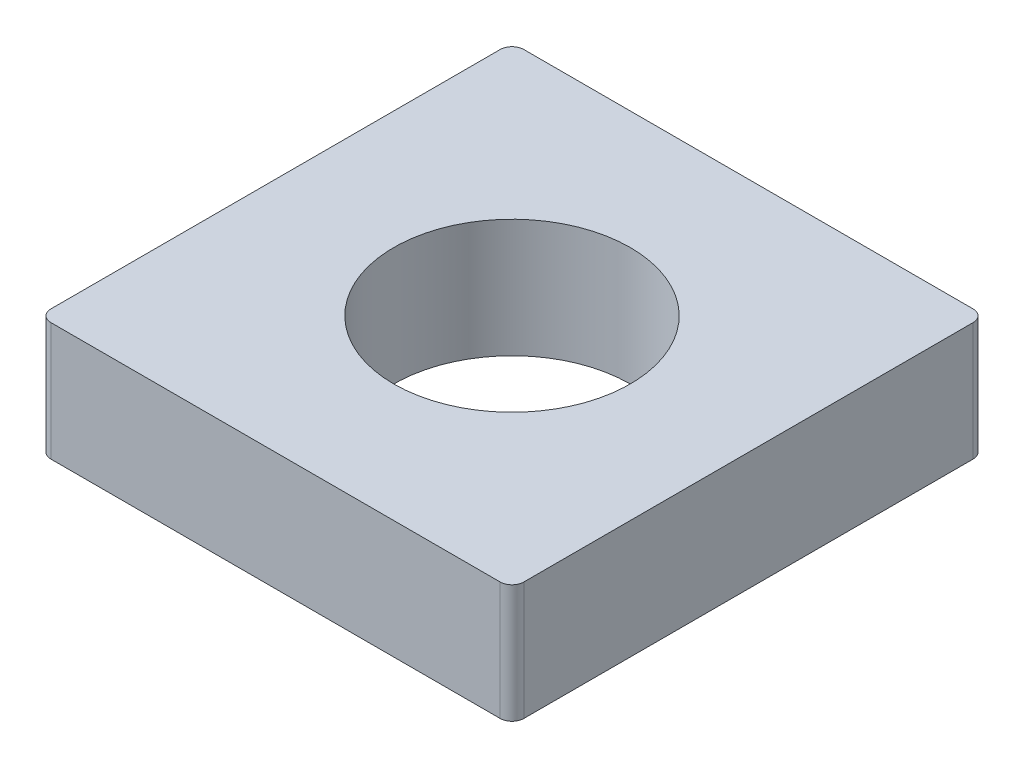
from build123d import *

# Parameters (mm, degrees)
SKETCH_1_W      = 8
SKETCH_1_H      = 8
SKETCH_1_R      = 2
EXTRUDE_1_DEPTH = 1
FILLET_1_R      = 0.2


with BuildPart() as part:
    # 草图1 → 凸台-拉伸1 (new, symmetric)
    with BuildSketch(Plane(origin=(0, 0, 0), x_dir=(1, 0, 0), z_dir=(0, 1, 0))):
        Rectangle(SKETCH_1_W, SKETCH_1_H)
        with Locations(Location((0, 0, 0), (0, 0, 270))):
            Circle(SKETCH_1_R, mode=Mode.SUBTRACT)
    extrude(amount=EXTRUDE_1_DEPTH, both=True)

    # 圆角1
    fillet_1_edges = [part.edges().sort_by_distance(p)[0] for p in [
        (4, 0, 4),
        (-4, 0, 4),
        (-4, 0, -4),
        (4, 0, -4),
    ]]
    fillet(fillet_1_edges, radius=FILLET_1_R)


solid = part.part
